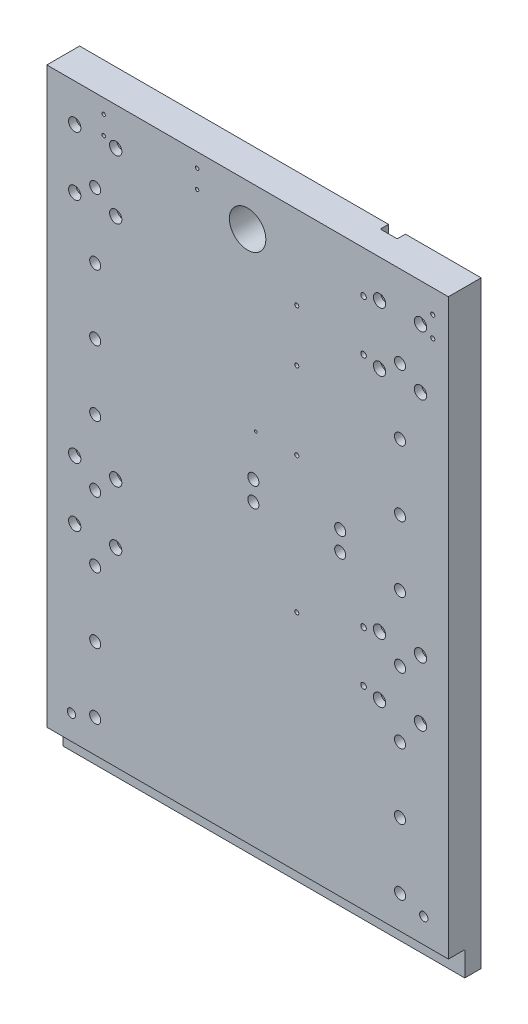
from build123d import *

# Parameters (mm, degrees)
SKETCH1_W                                            = 490
SKETCH1_H                                            = 730
BOSS_EXTRUDE1_DEPTH                                  = 50.8
SKETCH3_W                                            = 5
SKETCH3_H                                            = 730
CUT_EXTRUDE1_DEPTH                                   = 614.111441746
M5_TAPPED_HOLE1_D                                    = 4.2
M5_TAPPED_HOLE1_DEPTH                                = 23.5
M5_TAPPED_HOLE1_TIP                                  = 1.2618073
M12_CLEARANCE_HOLE1_D                                = 13.5
CUT_EXTRUDE2_DEPTH                                   = 5.08
CBORE_FOR_M12_HEX_SOCKET_HEAD_CAP_SCREW1_D           = 13.5
CBORE_FOR_M12_HEX_SOCKET_HEAD_CAP_SCREW1_CBORE_D     = 20
CBORE_FOR_M12_HEX_SOCKET_HEAD_CAP_SCREW1_CBORE_DEPTH = 13
LPATTERN1_COUNT                                      = 8
LPATTERN1_PITCH                                      = 80
CBORE_FOR_M8_HEX_SOCKET_HEAD_CAP_SCREW1_D            = 9
CBORE_FOR_M8_HEX_SOCKET_HEAD_CAP_SCREW1_CBORE_D      = 15
CBORE_FOR_M8_HEX_SOCKET_HEAD_CAP_SCREW1_CBORE_DEPTH  = 9
LPATTERN2_COUNT                                      = 2
LPATTERN2_PITCH                                      = 50
LPATTERN2_COUNT_DIR2                                 = 2
LPATTERN2_PITCH_DIR2                                 = 72
LPATTERN5_COUNT                                      = 2
LPATTERN5_PITCH                                      = 372
LPATTERN5_COUNT_DIR2                                 = 2
LPATTERN5_PITCH_DIR2                                 = 350
LPATTERN5_COPY_1_D                                   = 9
LPATTERN5_COPY_1_CBORE_D                             = 15
LPATTERN5_COPY_1_CBORE_DEPTH                         = 9
LPATTERN5_COPY_2_D                                   = 9
LPATTERN5_COPY_2_CBORE_D                             = 15
LPATTERN5_COPY_2_CBORE_DEPTH                         = 9
LPATTERN5_COPY_3_D                                   = 9
LPATTERN5_COPY_3_CBORE_D                             = 15
LPATTERN5_COPY_3_CBORE_DEPTH                         = 9
LPATTERN5_COPY_4_D                                   = 9
LPATTERN5_COPY_4_CBORE_D                             = 15
LPATTERN5_COPY_4_CBORE_DEPTH                         = 9
LPATTERN5_COPY_5_D                                   = 9
LPATTERN5_COPY_5_CBORE_D                             = 15
LPATTERN5_COPY_5_CBORE_DEPTH                         = 9
LPATTERN5_COPY_6_D                                   = 9
LPATTERN5_COPY_6_CBORE_D                             = 15
LPATTERN5_COPY_6_CBORE_DEPTH                         = 9
LPATTERN5_COPY_7_D                                   = 9
LPATTERN5_COPY_7_CBORE_D                             = 15
LPATTERN5_COPY_7_CBORE_DEPTH                         = 9
LPATTERN5_COPY_8_D                                   = 9
LPATTERN5_COPY_8_CBORE_D                             = 15
LPATTERN5_COPY_8_CBORE_DEPTH                         = 9
LPATTERN5_COPY_9_D                                   = 9
LPATTERN5_COPY_9_CBORE_D                             = 15
LPATTERN5_COPY_9_CBORE_DEPTH                         = 9
M6_TAPPED_HOLE1_D                                    = 5
M6_TAPPED_HOLE1_DEPTH                                = 27.99
M6_TAPPED_HOLE1_TIP                                  = 1.502151548
M6_TAPPED_HOLE2_D                                    = 5
M6_TAPPED_HOLE2_DEPTH                                = 27.99
M6_TAPPED_HOLE2_TIP                                  = 1.502151548
CUT_EXTRUDE3_DEPTH                                   = 10
FILLET1_R                                            = 0.79375
M8_TAPPED_HOLE1_D                                    = 6.8
M8_TAPPED_HOLE1_DEPTH                                = 32.99
M8_TAPPED_HOLE1_TIP                                  = 2.042926105
FILLET2_R                                            = 0.8128
FILLET3_R                                            = 0.79375
SKETCH22_R                                           = 22.225
CUT_EXTRUDE4_DEPTH                                   = 442.418169087
M4_TAPPED_HOLE1_D                                    = 3.3
M4_TAPPED_HOLE1_DEPTH                                = 13.51
M4_TAPPED_HOLE1_TIP                                  = 0.991420021
M12_TAPPED_HOLE1_D                                   = 10.2
M12_TAPPED_HOLE1_DEPTH                               = 43.99
M12_TAPPED_HOLE1_TIP                                 = 3.064389157


with BuildPart() as part:
    # Sketch1 → Boss-Extrude1 (new body)
    with BuildSketch(Plane.XY):
        Rectangle(SKETCH1_W, SKETCH1_H)
    extrude(amount=BOSS_EXTRUDE1_DEPTH)

    # Sketch3 → Cut-Extrude1 (cut, through all)
    with BuildSketch(Plane.ZY.offset(245)):
        with Locations((2.5, 0)):
            Rectangle(SKETCH3_W, SKETCH3_H)
        Polygon((45, -335), (25, -335), (25, -365), (50.8, -365), (50.8, 365), (45, 365), align=None)
    extrude(amount=-CUT_EXTRUDE1_DEPTH, mode=Mode.SUBTRACT)

    # M5 Tapped Hole1
    with Locations(Plane.XY.offset(45)):
        with Locations((-175.625, 347.5), (-61.625, 347.5), (-61.625, 325), (-175.625, 325)):
            Hole(M5_TAPPED_HOLE1_D / 2, depth=M5_TAPPED_HOLE1_DEPTH)
            with Locations((0, 0, -(M5_TAPPED_HOLE1_DEPTH + M5_TAPPED_HOLE1_TIP / 2))):  # 118° drill point
                Cone(0, M5_TAPPED_HOLE1_D / 2, M5_TAPPED_HOLE1_TIP, mode=Mode.SUBTRACT)

    # M12 Clearance Hole1 (through all)
    with Locations(Plane(origin=(0, 0, 5), x_dir=(-1, 0, 0), z_dir=(0, 0, -1))):
        with Locations((-113, 53), (-7, 53), (-7, 29), (-113, 29)):
            Hole(M12_CLEARANCE_HOLE1_D / 2)

    # Sketch8 → Cut-Extrude2 (cut)
    with BuildSketch(Plane(origin=(0, 0, 5), x_dir=(-1, 0, 0), z_dir=(0, 0, -1))):
        with BuildLine():
            Line((-82.5, 47), (-37.5, 47))
            ThreePointArc((-37.5, 47), (-31.5, 41), (-37.5, 35))
            Line((-37.5, 35), (-82.5, 35))
            ThreePointArc((-82.5, 35), (-88.5, 41), (-82.5, 47))
        make_face()
    extrude(amount=-CUT_EXTRUDE2_DEPTH, mode=Mode.SUBTRACT)

    # CBORE for M12 Hex Socket Head Cap Screw1 (through all)
    with Locations(Plane(origin=(0, 0, 5), x_dir=(-1, 0, 0), z_dir=(0, 0, -1))):
        with Locations((-186, -295), (186, -295)):
            cbore_for_m12_hex_socket_head_cap_screw1 = CounterBoreHole(CBORE_FOR_M12_HEX_SOCKET_HEAD_CAP_SCREW1_D / 2, CBORE_FOR_M12_HEX_SOCKET_HEAD_CAP_SCREW1_CBORE_D / 2, CBORE_FOR_M12_HEX_SOCKET_HEAD_CAP_SCREW1_CBORE_DEPTH)

    # LPattern1: CBORE for M12 Hex Socket Head Cap Screw1 ×8
    with Locations(*[(0, i * LPATTERN1_PITCH, 0) for i in range(1, LPATTERN1_COUNT)]):
        add(cbore_for_m12_hex_socket_head_cap_screw1, mode=Mode.SUBTRACT)

    # CBORE for M8 Hex Socket Head Cap Screw1 (through all)
    with Locations(Plane.XY.offset(45)):
        with Locations((211, 319)):
            cbore_for_m8_hex_socket_head_cap_screw1 = CounterBoreHole(CBORE_FOR_M8_HEX_SOCKET_HEAD_CAP_SCREW1_D / 2, CBORE_FOR_M8_HEX_SOCKET_HEAD_CAP_SCREW1_CBORE_D / 2, CBORE_FOR_M8_HEX_SOCKET_HEAD_CAP_SCREW1_CBORE_DEPTH)

    # LPattern2: CBORE for M8 Hex Socket Head Cap Screw1 2 × 2
    with Locations(*[(-i * LPATTERN2_PITCH, -j * LPATTERN2_PITCH_DIR2, 0) for i in range(LPATTERN2_COUNT) for j in range(LPATTERN2_COUNT_DIR2) if (i, j) != (0, 0)]):
        add(cbore_for_m8_hex_socket_head_cap_screw1, mode=Mode.SUBTRACT)

    # LPattern5: CBORE for M8 Hex Socket Head Cap Screw1 2 × 2
    with Locations(*[(-i * LPATTERN5_PITCH, -j * LPATTERN5_PITCH_DIR2, 0) for i in range(LPATTERN5_COUNT) for j in range(LPATTERN5_COUNT_DIR2) if (i, j) != (0, 0)]):
        add(cbore_for_m8_hex_socket_head_cap_screw1, mode=Mode.SUBTRACT)

    # LPattern5 copy 1 (through all)
    with Locations(Plane(origin=(0, -422, 45), x_dir=(1, 0, 0), z_dir=(0, 0, 1))):
        with Locations((211, 319)):
            CounterBoreHole(LPATTERN5_COPY_1_D / 2, LPATTERN5_COPY_1_CBORE_D / 2, LPATTERN5_COPY_1_CBORE_DEPTH)

    # LPattern5 copy 2 (through all)
    with Locations(Plane(origin=(-372, -72, 45), x_dir=(1, 0, 0), z_dir=(0, 0, 1))):
        with Locations((211, 319)):
            CounterBoreHole(LPATTERN5_COPY_2_D / 2, LPATTERN5_COPY_2_CBORE_D / 2, LPATTERN5_COPY_2_CBORE_DEPTH)

    # LPattern5 copy 3 (through all)
    with Locations(Plane(origin=(-372, -422, 45), x_dir=(1, 0, 0), z_dir=(0, 0, 1))):
        with Locations((211, 319)):
            CounterBoreHole(LPATTERN5_COPY_3_D / 2, LPATTERN5_COPY_3_CBORE_D / 2, LPATTERN5_COPY_3_CBORE_DEPTH)

    # LPattern5 copy 4 (through all)
    with Locations(Plane(origin=(-50, -350, 45), x_dir=(1, 0, 0), z_dir=(0, 0, 1))):
        with Locations((211, 319)):
            CounterBoreHole(LPATTERN5_COPY_4_D / 2, LPATTERN5_COPY_4_CBORE_D / 2, LPATTERN5_COPY_4_CBORE_DEPTH)

    # LPattern5 copy 5 (through all)
    with Locations(Plane(origin=(-422, 0, 45), x_dir=(1, 0, 0), z_dir=(0, 0, 1))):
        with Locations((211, 319)):
            CounterBoreHole(LPATTERN5_COPY_5_D / 2, LPATTERN5_COPY_5_CBORE_D / 2, LPATTERN5_COPY_5_CBORE_DEPTH)

    # LPattern5 copy 6 (through all)
    with Locations(Plane(origin=(-422, -350, 45), x_dir=(1, 0, 0), z_dir=(0, 0, 1))):
        with Locations((211, 319)):
            CounterBoreHole(LPATTERN5_COPY_6_D / 2, LPATTERN5_COPY_6_CBORE_D / 2, LPATTERN5_COPY_6_CBORE_DEPTH)

    # LPattern5 copy 7 (through all)
    with Locations(Plane(origin=(-50, -422, 45), x_dir=(1, 0, 0), z_dir=(0, 0, 1))):
        with Locations((211, 319)):
            CounterBoreHole(LPATTERN5_COPY_7_D / 2, LPATTERN5_COPY_7_CBORE_D / 2, LPATTERN5_COPY_7_CBORE_DEPTH)

    # LPattern5 copy 8 (through all)
    with Locations(Plane(origin=(-422, -72, 45), x_dir=(1, 0, 0), z_dir=(0, 0, 1))):
        with Locations((211, 319)):
            CounterBoreHole(LPATTERN5_COPY_8_D / 2, LPATTERN5_COPY_8_CBORE_D / 2, LPATTERN5_COPY_8_CBORE_DEPTH)

    # LPattern5 copy 9 (through all)
    with Locations(Plane(origin=(-422, -422, 45), x_dir=(1, 0, 0), z_dir=(0, 0, 1))):
        with Locations((211, 319)):
            CounterBoreHole(LPATTERN5_COPY_9_D / 2, LPATTERN5_COPY_9_CBORE_D / 2, LPATTERN5_COPY_9_CBORE_DEPTH)

    # M6 Tapped Hole1
    with Locations(Plane.XY.offset(45)):
        with Locations((225.95, 336.5), (225.95, 311.5)):
            Hole(M6_TAPPED_HOLE1_D / 2, depth=M6_TAPPED_HOLE1_DEPTH)
            with Locations((0, 0, -(M6_TAPPED_HOLE1_DEPTH + M6_TAPPED_HOLE1_TIP / 2))):  # 118° drill point
                Cone(0, M6_TAPPED_HOLE1_D / 2, M6_TAPPED_HOLE1_TIP, mode=Mode.SUBTRACT)

    # M6 Tapped Hole2
    with Locations(Plane.XY.offset(45)):
        with Locations((60, 105), (60, -61), (60, 263.4), (60, 199.9)):
            Hole(M6_TAPPED_HOLE2_D / 2, depth=M6_TAPPED_HOLE2_DEPTH)
            with Locations((0, 0, -(M6_TAPPED_HOLE2_DEPTH + M6_TAPPED_HOLE2_TIP / 2))):  # 118° drill point
                Cone(0, M6_TAPPED_HOLE2_D / 2, M6_TAPPED_HOLE2_TIP, mode=Mode.SUBTRACT)

    # Sketch17 → Cut-Extrude3 (cut)
    with BuildSketch(Plane(origin=(0, 0, 5), x_dir=(-1, 0, 0), z_dir=(0, 0, -1))):
        with BuildLine():
            Line((-152.5875, 365), (-131.95, 365))
            Line((-131.95, 365), (-131.95, 222))
            ThreePointArc((-131.95, 222), (-142.26875, 211.68125), (-152.5875, 222))
            Line((-152.5875, 222), (-152.5875, 365))
        make_face()
        with BuildLine():
            Line((-131.95, -4.5), (-131.95, -129.5))
            ThreePointArc((-131.95, -129.5), (-142.26875, -139.81875), (-152.5875, -129.5))
            Line((-152.5875, -129.5), (-152.5875, -4.5))
            ThreePointArc((-152.5875, -4.5), (-142.26875, 5.81875), (-131.95, -4.5))
        make_face()
    extrude(amount=-CUT_EXTRUDE3_DEPTH, mode=Mode.SUBTRACT)

    # Fillet1
    fillet1_edges = [part.edges().sort_by_distance(p)[0] for p in [
        (152.5875, 293.5, 15),
        (131.95, 293.5, 15),
        (142.26875, 211.68125, 15),
        (142.26875, 5.81875, 15),
        (131.95, -67, 15),
        (142.26875, -139.81875, 15),
        (152.5875, -67, 15),
    ]]
    fillet(fillet1_edges, radius=FILLET1_R)

    # M8 Tapped Hole1
    with Locations(Plane(origin=(0, 0, 15), x_dir=(-1, 0, 0), z_dir=(0, 0, -1))):
        with Locations((-141.475, 314), (-141.475, 252), (-141.475, -36), (-141.475, -98)):
            Hole(M8_TAPPED_HOLE1_D / 2, depth=M8_TAPPED_HOLE1_DEPTH)
            with Locations((0, 0, -(M8_TAPPED_HOLE1_DEPTH + M8_TAPPED_HOLE1_TIP / 2))):  # 118° drill point
                Cone(0, M8_TAPPED_HOLE1_D / 2, M8_TAPPED_HOLE1_TIP, mode=Mode.SUBTRACT)

    # Fillet2
    fillet2_edges = [part.edges().sort_by_distance(p)[0] for p in [
        (0, -335, 25),
    ]]
    fillet(fillet2_edges, radius=FILLET2_R)

    # Fillet3
    fillet3_edges = [part.edges().sort_by_distance(p)[0] for p in [
        (88.5, 41, 10.08),
        (60, 47, 10.08),
        (31.5, 41, 10.08),
        (60, 35, 10.08),
    ]]
    fillet(fillet3_edges, radius=FILLET3_R)

    # Sketch22 → Cut-Extrude4 (cut, through all)
    with BuildSketch(Plane.XY.offset(45)):
        with Locations((0, 314)):
            Circle(SKETCH22_R)
    extrude(amount=-CUT_EXTRUDE4_DEPTH, mode=Mode.SUBTRACT)

    # M4 Tapped Hole1
    with Locations(Plane.XY.offset(45)):
        with Locations((10, 105)):
            Hole(M4_TAPPED_HOLE1_D / 2, depth=M4_TAPPED_HOLE1_DEPTH)
            with Locations((0, 0, -(M4_TAPPED_HOLE1_DEPTH + M4_TAPPED_HOLE1_TIP / 2))):  # 118° drill point
                Cone(0, M4_TAPPED_HOLE1_D / 2, M4_TAPPED_HOLE1_TIP, mode=Mode.SUBTRACT)

    # M12 Tapped Hole1
    with Locations(Plane(origin=(0, 0, 5), x_dir=(-1, 0, 0), z_dir=(0, 0, -1))):
        with Locations((215, -305), (-215, -305)):
            Hole(M12_TAPPED_HOLE1_D / 2, depth=M12_TAPPED_HOLE1_DEPTH)
            with Locations((0, 0, -(M12_TAPPED_HOLE1_DEPTH + M12_TAPPED_HOLE1_TIP / 2))):  # 118° drill point
                Cone(0, M12_TAPPED_HOLE1_D / 2, M12_TAPPED_HOLE1_TIP, mode=Mode.SUBTRACT)


solid = part.part
